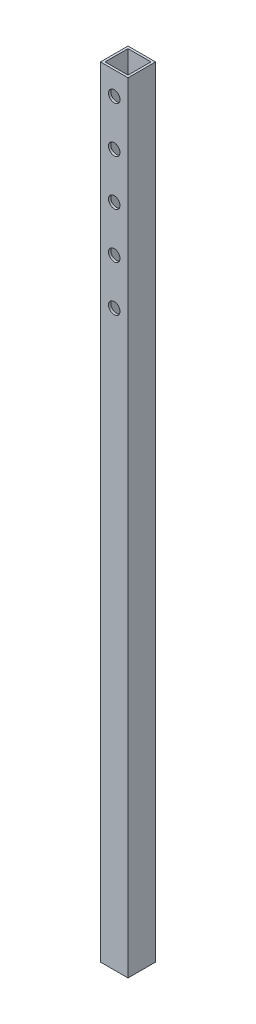
from build123d import *

# Parameters (mm, degrees)
SKETCH1_W           = 30.48
SKETCH1_H           = 30.48
SKETCH1_W_2         = 25.4
SKETCH1_H_2         = 25.4
EXTRUDE_THIN1_DEPTH = 863.6
SKETCH2_R           = 6.35
CUT_EXTRUDE1_DEPTH  = 865.272091416
LPATTERN1_COUNT     = 5
LPATTERN1_PITCH     = 50.8


with BuildPart() as part:
    # Sketch1 → Extrude-Thin1 (new body)
    with BuildSketch(Plane(origin=(0, 0, 0), x_dir=(1, 0, 0), z_dir=(0, 1, 0))):
        Rectangle(SKETCH1_W, SKETCH1_H)
        Rectangle(SKETCH1_W_2, SKETCH1_H_2, mode=Mode.SUBTRACT)
    extrude(amount=EXTRUDE_THIN1_DEPTH)

    # Sketch2 → Cut-Extrude1 (cut, through all)
    with BuildSketch(Plane.XY.offset(15.24)):
        with Locations((0, 838.2)):
            Circle(SKETCH2_R)
    cut_extrude1 = extrude(amount=-CUT_EXTRUDE1_DEPTH, mode=Mode.SUBTRACT)

    # LPattern1: Cut-Extrude1 ×5
    with Locations(*[(0, -i * LPATTERN1_PITCH, 0) for i in range(1, LPATTERN1_COUNT)]):
        add(cut_extrude1, mode=Mode.SUBTRACT)


solid = part.part
